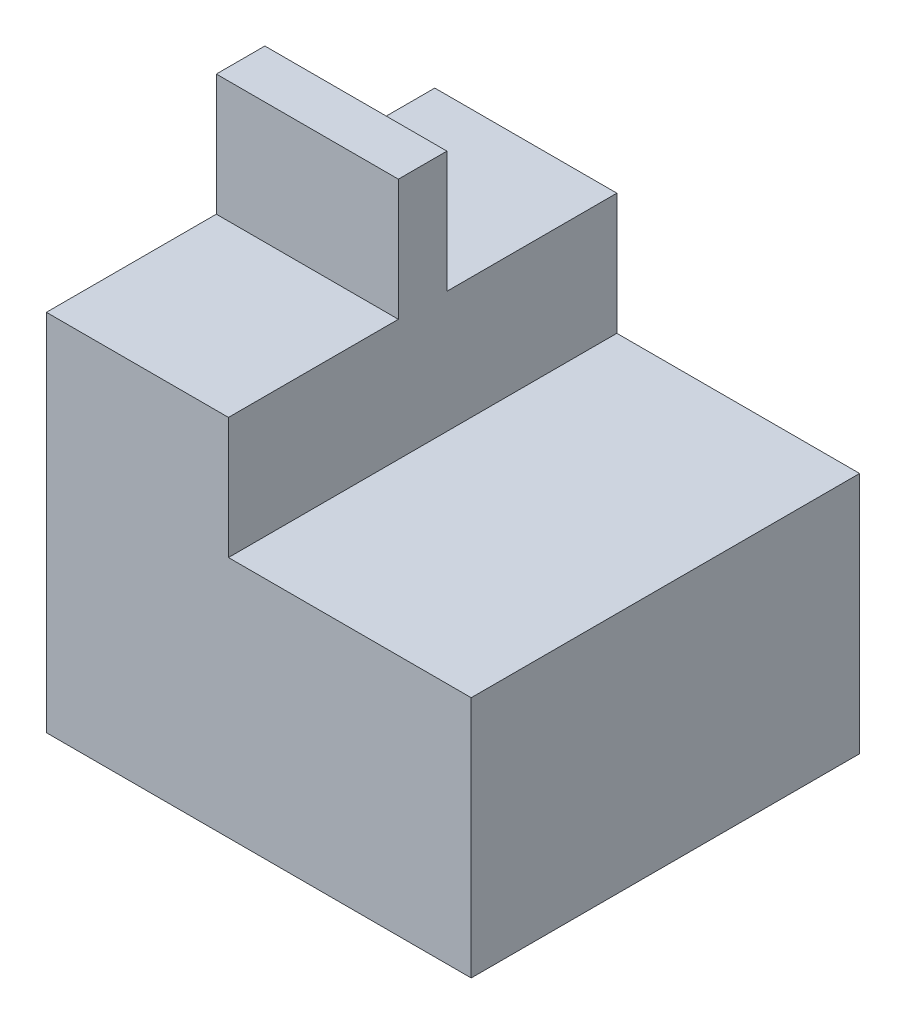
from build123d import *

# Parameters (mm, degrees)
BOSS_EXTRUDE1_DEPTH = 32
SKETCH2_W           = 14
SKETCH2_H           = 10
SKETCH2_W_2         = 12
CUT_EXTRUDE1_DEPTH  = 51.049529889


with BuildPart() as part:
    # Sketch1 → Boss-Extrude1 (new body)
    with BuildSketch(Plane.XY):
        Polygon((-36.032249566, 32.877886825), (-51.032249566, 32.877886825), (-51.032249566, -7.122113175), (-16.032249566, -7.122113175), (-16.032249566, 12.877886825), (-36.032249566, 12.877886825), align=None)
    extrude(amount=BOSS_EXTRUDE1_DEPTH)

    # Sketch2 → Cut-Extrude1 (cut, through all)
    with BuildSketch(Plane(origin=(-36.032249566, 0, 0), x_dir=(0, 0, -1), z_dir=(1, 0, 0))):
        with Locations((-7, 27.877886825)):
            Rectangle(SKETCH2_W, SKETCH2_H)
        with Locations((-25, 27.877886825)):
            Rectangle(SKETCH2_W, SKETCH2_H)
        with Locations((-16, -7.122113175)):
            Rectangle(SKETCH2_W_2, SKETCH2_H)
    extrude(amount=-CUT_EXTRUDE1_DEPTH, mode=Mode.SUBTRACT)


solid = part.part
